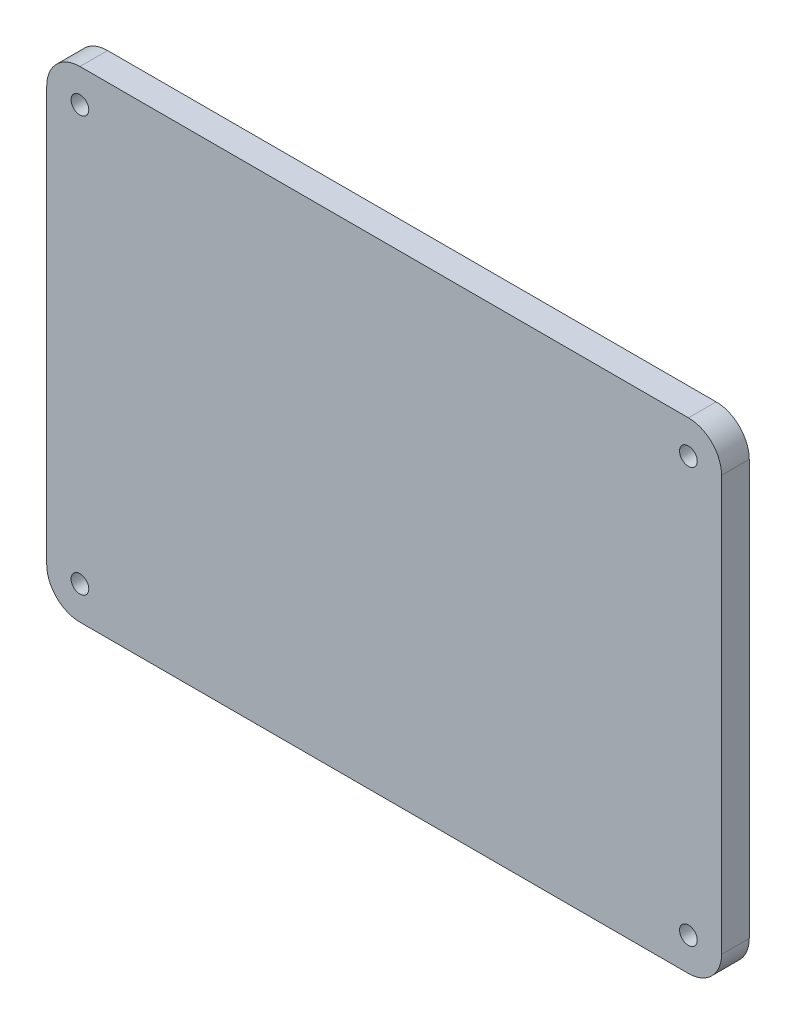
from build123d import *

# Parameters (mm, degrees)
SKETCH_1_R      = 1.6
EXTRUDE_1_DEPTH = 5


with BuildPart() as part:
    # Эскиз1 → Бобышка-Вытянуть1 (new body)
    with BuildSketch(Plane.XY):
        with BuildLine():
            Line((130, -14), (20, -14))
            ThreePointArc((20, -14), (15.757359313, -12.242640687), (14, -8))
            Line((14, -8), (14, 67))
            ThreePointArc((14, 67), (15.757359313, 71.242640687), (20, 73))
            Line((20, 73), (130, 73))
            ThreePointArc((130, 73), (134.242640687, 71.242640687), (136, 67))
            Line((136, 67), (136, -8))
            ThreePointArc((136, -8), (134.242640687, -12.242640687), (130, -14))
        make_face()
        with Locations((130, 67)):
            Circle(SKETCH_1_R, mode=Mode.SUBTRACT)
        with Locations((20, 67)):
            Circle(SKETCH_1_R, mode=Mode.SUBTRACT)
        with Locations((20, -8)):
            Circle(SKETCH_1_R, mode=Mode.SUBTRACT)
        with Locations((130, -8)):
            Circle(SKETCH_1_R, mode=Mode.SUBTRACT)
    extrude(amount=EXTRUDE_1_DEPTH)


solid = part.part
